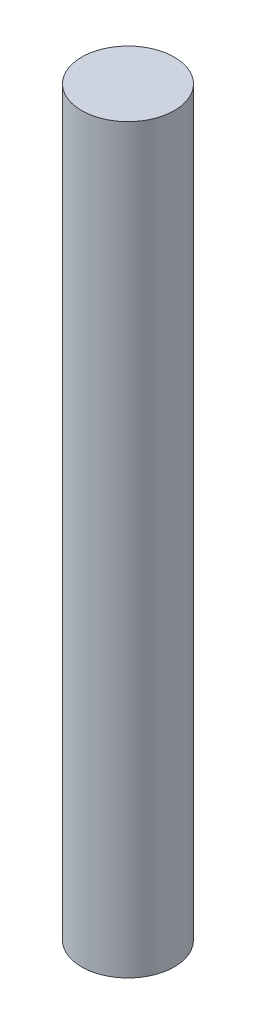
from build123d import *

# Parameters (mm, degrees)
SKETCH1_R           = 5
BOSS_EXTRUDE1_DEPTH = 80
ESCALA1_SCALE       = 0.2


with BuildPart() as part:
    # Sketch1 → Boss-Extrude1 (new body)
    with BuildSketch(Plane(origin=(0, 0, 0), x_dir=(1, 0, 0), z_dir=(0, 1, 0))):
        with Locations(Location((0, 0, 0), (0, 0, 270))):
            Circle(SKETCH1_R)
    extrude(amount=BOSS_EXTRUDE1_DEPTH)


with BuildPart() as part_1:
    # Escala1: scaled about (0, 40, 0)
    add(part.part.scale(ESCALA1_SCALE).moved(Location((0, 32, 0))))


solid = part_1.part
